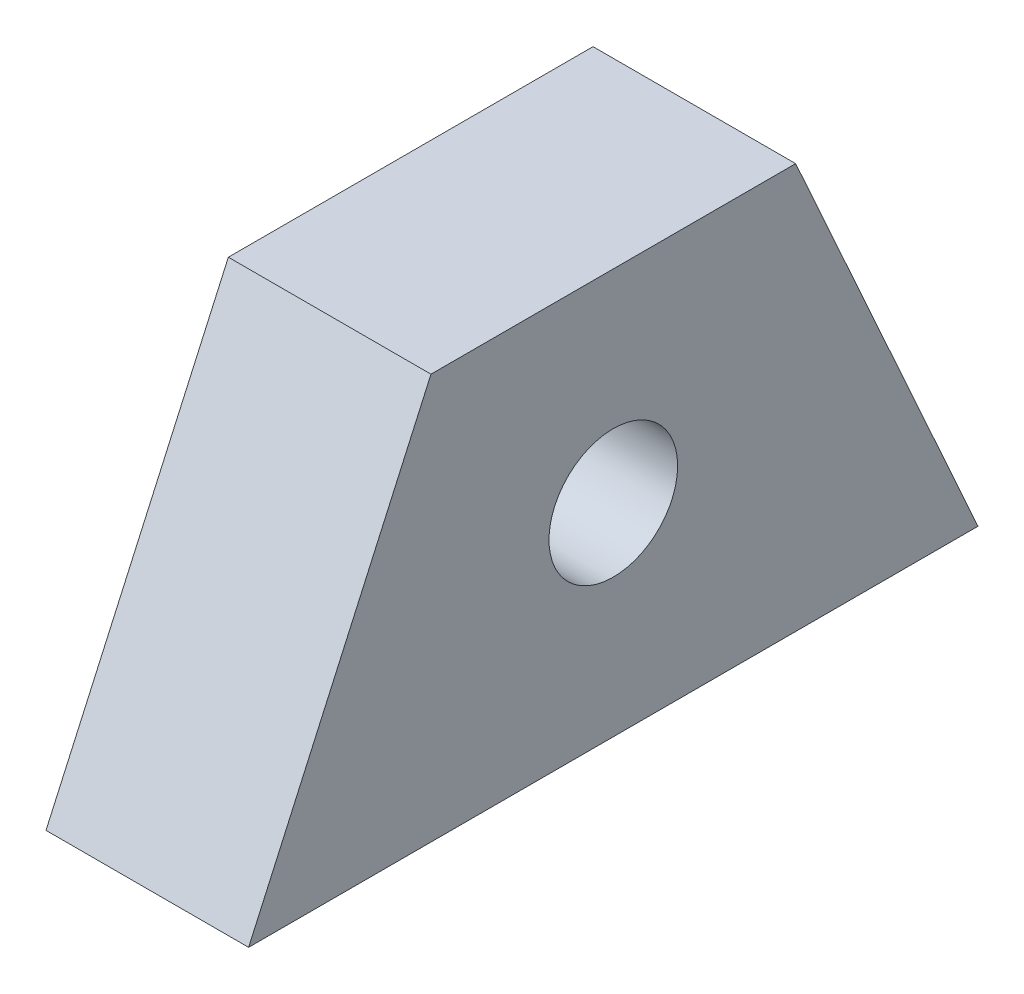
from build123d import *

# Parameters (mm, degrees)
BOSS_EXTRUDE1_DEPTH = 10


with BuildPart() as part:
    # Sketch1 → Boss-Extrude1 (new body)
    with BuildSketch(Plane(origin=(0, 0, 0), x_dir=(0, 0, -1), z_dir=(1, 0, 0))):
        with BuildLine():
            Line((0, 6.825), (0, 0))
            Line((0, 0), (18, 0))
            Line((18, 0), (9, 20))
            Line((9, 20), (0, 20))
            Line((0, 20), (0, 13.175))
            ThreePointArc((0, 13.175), (2.24506403, 12.24506403), (3.175, 10))
            ThreePointArc((3.175, 10), (2.24506403, 7.75493597), (0, 6.825))
        make_face()
        with BuildLine():
            Line((-18, 0), (0, 0))
            Line((0, 0), (0, 6.825))
            ThreePointArc((0, 6.825), (-3.175, 10), (0, 13.175))
            Line((0, 13.175), (0, 20))
            Line((0, 20), (-9, 20))
            Line((-9, 20), (-18, 0))
        make_face()
    extrude(amount=BOSS_EXTRUDE1_DEPTH)


solid = part.part
